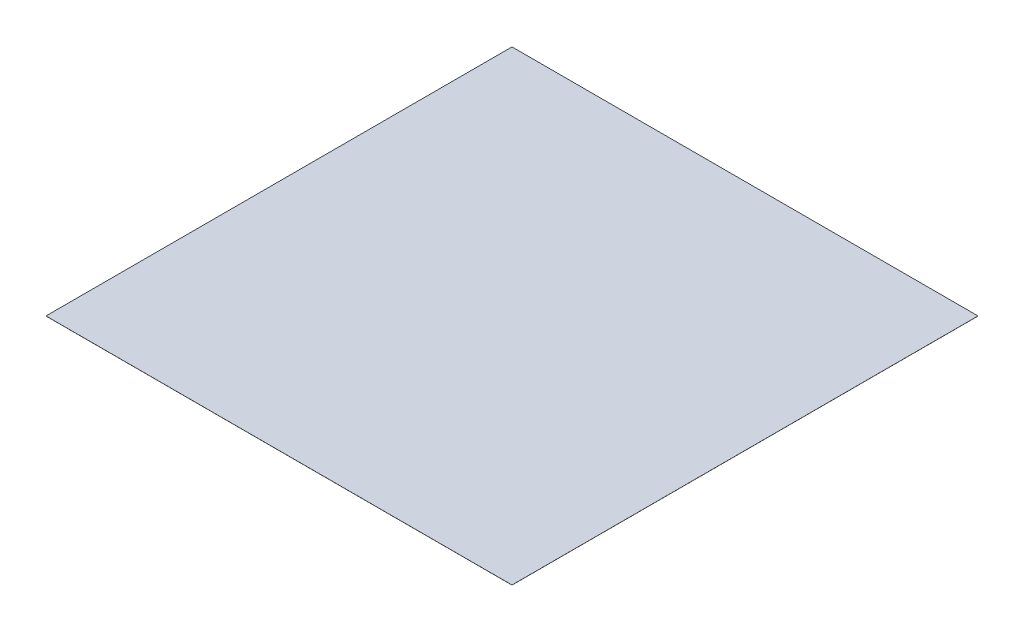
from build123d import *

# Parameters (mm, degrees)
SKETCH1_W           = 12700
SKETCH1_H           = 12700
BOSS_EXTRUDE1_DEPTH = 2.54


with BuildPart() as part:
    # Sketch1 → Boss-Extrude1 (new body)
    with BuildSketch(Plane(origin=(0, 0, 0), x_dir=(1, 0, 0), z_dir=(0, 1, 0))):
        with Locations((6350, 6350)):
            Rectangle(SKETCH1_W, SKETCH1_H)
    extrude(amount=BOSS_EXTRUDE1_DEPTH)


solid = part.part
